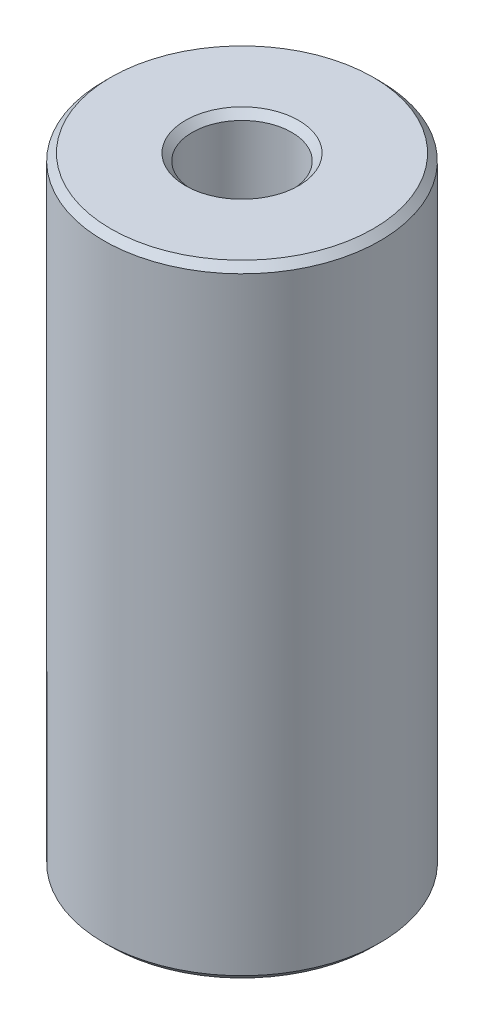
from build123d import *

# Parameters (mm, degrees)
SKICA2_R                = 10
SKICA2_R_2              = 3.6
P_IDAT_VYSUNUT_M1_DEPTH = 45
ZKOSEN_1_SIZE           = 0.5


with BuildPart() as part:
    # Skica2 → Přidat vysunutím1 (new body)
    with BuildSketch(Plane(origin=(0, 0, 0), x_dir=(1, 0, 0), z_dir=(0, 1, 0))):
        with Locations(Location((0, 0, 0), (0, 0, 90))):
            Circle(SKICA2_R)
        with Locations(Location((0, 0, 0), (0, 0, 90))):
            Circle(SKICA2_R_2, mode=Mode.SUBTRACT)
    extrude(amount=P_IDAT_VYSUNUT_M1_DEPTH)

    # Zkosení1
    zkosen_1_edges = [part.edges().sort_by_distance(p)[0] for p in [
        (0, 0, 10),
        (0, 45, 10),
        (0, 0, 3.6),
        (0, 45, 3.6),
    ]]
    chamfer(zkosen_1_edges, length=ZKOSEN_1_SIZE)


solid = part.part
